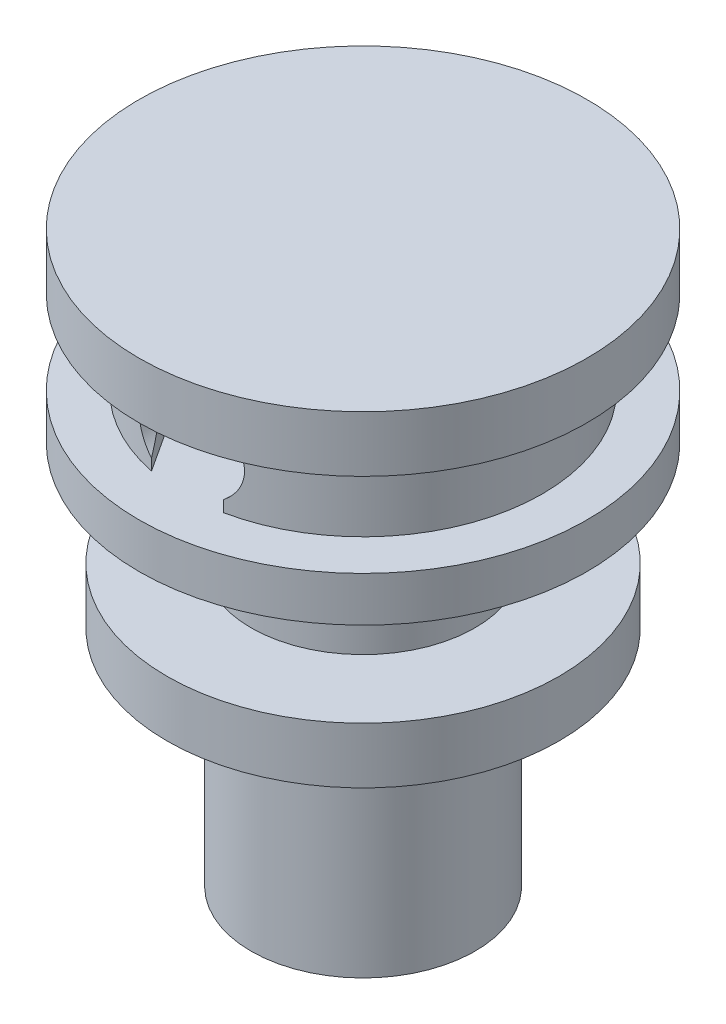
from build123d import *

# Parameters (mm, degrees)
CROQUIS1_R                 = 1
SALIENTE_EXTRUIR1_DEPTH    = 2
CROQUIS2_R                 = 1.75
SALIENTE_EXTRUIR2_DEPTH    = 0.5
CROQUIS3_R                 = 1
SALIENTE_EXTRUIR3_DEPTH    = 0.935
CROQUIS4_R                 = 2
SALIENTE_EXTRUIR4_DEPTH    = 0.4
CROQUIS6_R                 = 1.6
SALIENTE_EXTRUIR5_DEPTH    = 0.75
CROQUIS7_R                 = 2
SALIENTE_EXTRUIR6_DEPTH    = 0.5
CORTAR_EXTRUIR2_DEPTH      = 10
CORTAR_EXTRUIR2_DEPTH_BACK = 10
CROQUIS11_RX               = 0.471075949
CROQUIS11_RY               = 0.375
CORTAR_EXTRUIR3_START      = 0.75
CROQUIS12_R                = 1
CORTAR_EXTRUIR3_DEPTH      = 0.75
CORTAR_EXTRUIR4_DEPTH      = 0.75


with BuildPart() as part:
    # Croquis1 → Saliente-Extruir1 (new body)
    with BuildSketch(Plane(origin=(0, 0, 0), x_dir=(1, 0, 0), z_dir=(0, 1, 0))):
        Circle(CROQUIS1_R)
    extrude(amount=SALIENTE_EXTRUIR1_DEPTH)

    # Croquis2 → Saliente-Extruir2 (add)
    with BuildSketch(Plane(origin=(0, 2, 0), x_dir=(1, 0, 0), z_dir=(0, 1, 0))):
        Circle(CROQUIS2_R)
    extrude(amount=SALIENTE_EXTRUIR2_DEPTH)

    # Croquis3 → Saliente-Extruir3 (add)
    with BuildSketch(Plane(origin=(0, 2.5, 0), x_dir=(1, 0, 0), z_dir=(0, 1, 0))):
        Circle(CROQUIS3_R)
    extrude(amount=SALIENTE_EXTRUIR3_DEPTH)

    # Croquis4 → Saliente-Extruir4 (add)
    with BuildSketch(Plane(origin=(0, 3.435, 0), x_dir=(1, 0, 0), z_dir=(0, 1, 0))):
        Circle(CROQUIS4_R)
    extrude(amount=SALIENTE_EXTRUIR4_DEPTH)

    # Croquis6 → Saliente-Extruir5 (add)
    with BuildSketch(Plane(origin=(0, 3.835, 0), x_dir=(1, 0, 0), z_dir=(0, 1, 0))):
        Circle(CROQUIS6_R)
    extrude(amount=SALIENTE_EXTRUIR5_DEPTH)

    # Croquis7 → Saliente-Extruir6 (add)
    with BuildSketch(Plane(origin=(0, 4.585, 0), x_dir=(1, 0, 0), z_dir=(0, 1, 0))):
        Circle(CROQUIS7_R)
    extrude(amount=SALIENTE_EXTRUIR6_DEPTH)

    # Croquis11 → Cortar-Extruir2 (cut, two sides: drawn at the far end of the back side and taken through both)
    with BuildSketch(Plane.XY.offset(-CORTAR_EXTRUIR2_DEPTH_BACK)):
        with Locations(Location((0, 4.21), (0, 0, 180))):
            Ellipse(CROQUIS11_RX, CROQUIS11_RY)
    extrude(amount=CORTAR_EXTRUIR2_DEPTH + CORTAR_EXTRUIR2_DEPTH_BACK, mode=Mode.SUBTRACT)

    # Croquis12 → Cortar-Extruir3 (cut)
    with BuildSketch(Plane.XZ.offset(-4.585).offset(CORTAR_EXTRUIR3_START)):
        Circle(CROQUIS12_R)
    extrude(amount=-CORTAR_EXTRUIR3_DEPTH, mode=Mode.SUBTRACT)

    # Croquis13 → Cortar-Extruir4 (cut)
    with BuildSketch(Plane.XZ.offset(-4.585)):
        with BuildLine():
            Line((-0.3, -1.6), (-0.942474676, -0.614301623))
            ThreePointArc((-0.942474676, -0.614301623), (-1.125, 0), (-0.942474676, 0.614301623))
            Line((-0.942474676, 0.614301623), (-0.3, 1.6))
            Line((-0.3, 1.6), (0, 1.6))
            Line((0, 1.6), (0.3, 1.6))
            Line((0.3, 1.6), (0.942474676, 0.614301623))
            ThreePointArc((0.942474676, 0.614301623), (1.125, 0), (0.942474676, -0.614301623))
            Line((0.942474676, -0.614301623), (0.3, -1.6))
            Line((0.3, -1.6), (0, -1.6))
            Line((0, -1.6), (-0.3, -1.6))
        make_face()
    extrude(amount=CORTAR_EXTRUIR4_DEPTH, mode=Mode.SUBTRACT)


solid = part.part
